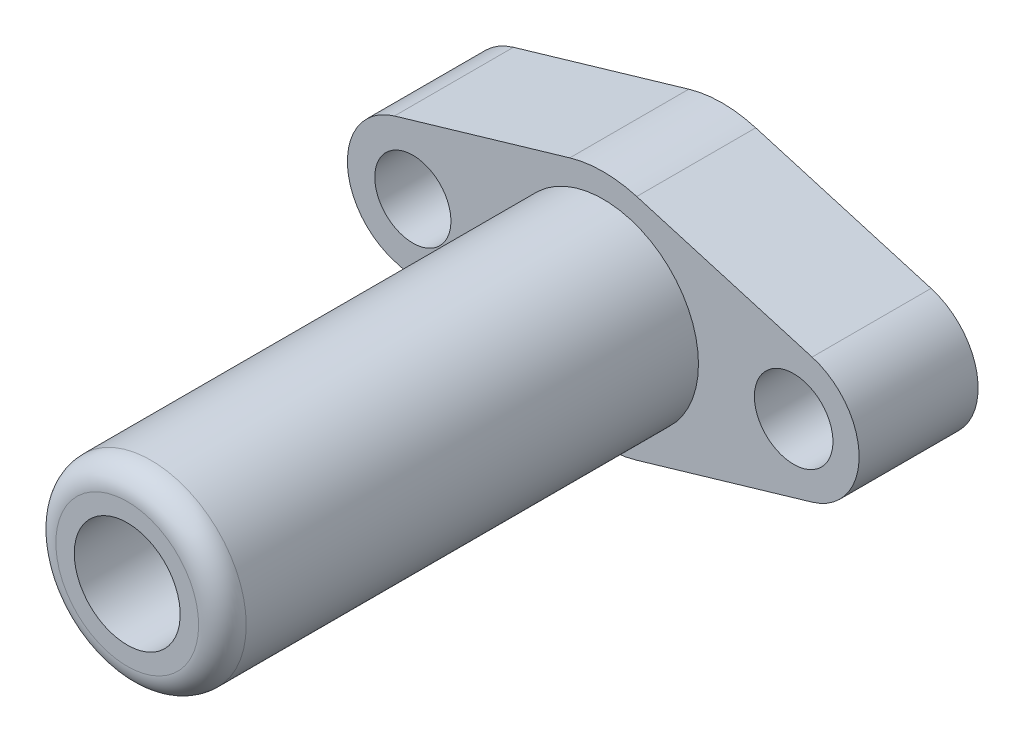
from build123d import *

# Parameters (mm, degrees)
SKETCH_1_R          = 4
EXTRUDE_1_DEPTH     = 20
SKETCH_2_R          = 1.65
SKETCH_2_R_2        = 1.6
EXTRUDE_2_DEPTH     = 5
SKETCH_3_R          = 2.25
CUT_EXTRUDE_1_DEPTH = 12
SKETCH_4_R          = 2.225
CUT_EXTRUDE_2_DEPTH = 18.59438831
FILLET_2_R          = 1


with BuildPart() as part:
    # 草图1 → 凸台-拉伸1 (new body)
    with BuildSketch(Plane.XY):
        Circle(SKETCH_1_R)
    extrude(amount=EXTRUDE_1_DEPTH)

    # 草图2 → 凸台-拉伸2 (add)
    with BuildSketch(Plane(origin=(0, 0, 0), x_dir=(-1, 0, 0), z_dir=(0, 0, -1))):
        with BuildLine():
            Line((-8.7734375, 2.638994967), (-1.40625, 4.798172666))
            ThreePointArc((-1.40625, 4.798172666), (0, 5), (1.40625, 4.798172666))
            Line((1.40625, 4.798172666), (8.7734375, 2.638994967))
            ThreePointArc((8.7734375, 2.638994967), (10.75, 0), (8.7734375, -2.638994967))
            Line((8.7734375, -2.638994967), (1.40625, -4.798172666))
            ThreePointArc((1.40625, -4.798172666), (0, -5), (-1.40625, -4.798172666))
            Line((-1.40625, -4.798172666), (-8.7734375, -2.638994967))
            ThreePointArc((-8.7734375, -2.638994967), (-10.75, 0), (-8.7734375, 2.638994967))
        make_face()
        with Locations((-8, 0)):
            Circle(SKETCH_2_R, mode=Mode.SUBTRACT)
        with Locations((8, 0)):
            Circle(SKETCH_2_R_2, mode=Mode.SUBTRACT)
    extrude(amount=EXTRUDE_2_DEPTH)

    # 草图3 → 切除-拉伸1 (cut)
    with BuildSketch(Plane(origin=(0, 0, -5), x_dir=(-1, 0, 0), z_dir=(0, 0, -1))):
        Circle(SKETCH_3_R)
    extrude(amount=-CUT_EXTRUDE_1_DEPTH, mode=Mode.SUBTRACT)

    # 草图4 → 切除-拉伸2 (cut, through all)
    with BuildSketch(Plane(origin=(0, 0, 7), x_dir=(-1, 0, 0), z_dir=(0, 0, -1))):
        Circle(SKETCH_4_R)
    extrude(amount=-CUT_EXTRUDE_2_DEPTH, mode=Mode.SUBTRACT)

    # 圆角2
    fillet_2_edges = [part.edges().sort_by_distance(p)[0] for p in [
        (-4, 0, 20),
    ]]
    fillet(fillet_2_edges, radius=FILLET_2_R)


solid = part.part
